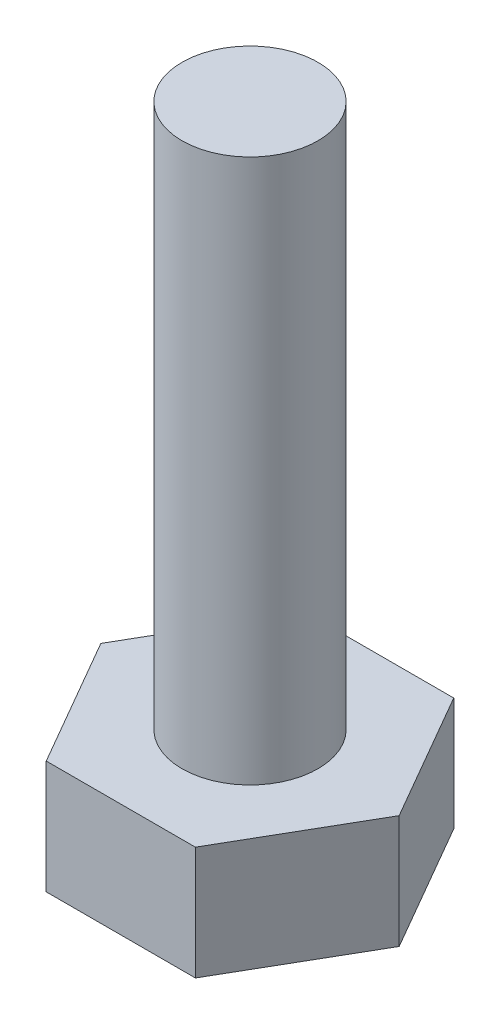
from build123d import *

# Parameters (mm, degrees)
BOLT_HEAD_DEPTH  = 2.5
SKETCH2_R        = 1.5
BOLT_SHAFT_DEPTH = 12


with BuildPart() as part:
    # Sketch1 → Bolt_Head (new body)
    with BuildSketch(Plane(origin=(0, 0, 0), x_dir=(1, 0, 0), z_dir=(0, 1, 0))):
        Polygon((3.290896534, 0), (1.645448267, 2.85), (-1.645448267, 2.85), (-3.290896534, 0), (-1.645448267, -2.85), (1.645448267, -2.85), align=None)
    extrude(amount=BOLT_HEAD_DEPTH)

    # Sketch2 → Bolt_Shaft (add)
    with BuildSketch(Plane(origin=(0, 2.5, 0), x_dir=(1, 0, 0), z_dir=(0, 1, 0))):
        with Locations(Location((0, 0, 0), (0, 0, 270))):
            Circle(SKETCH2_R)
    extrude(amount=BOLT_SHAFT_DEPTH)


solid = part.part
